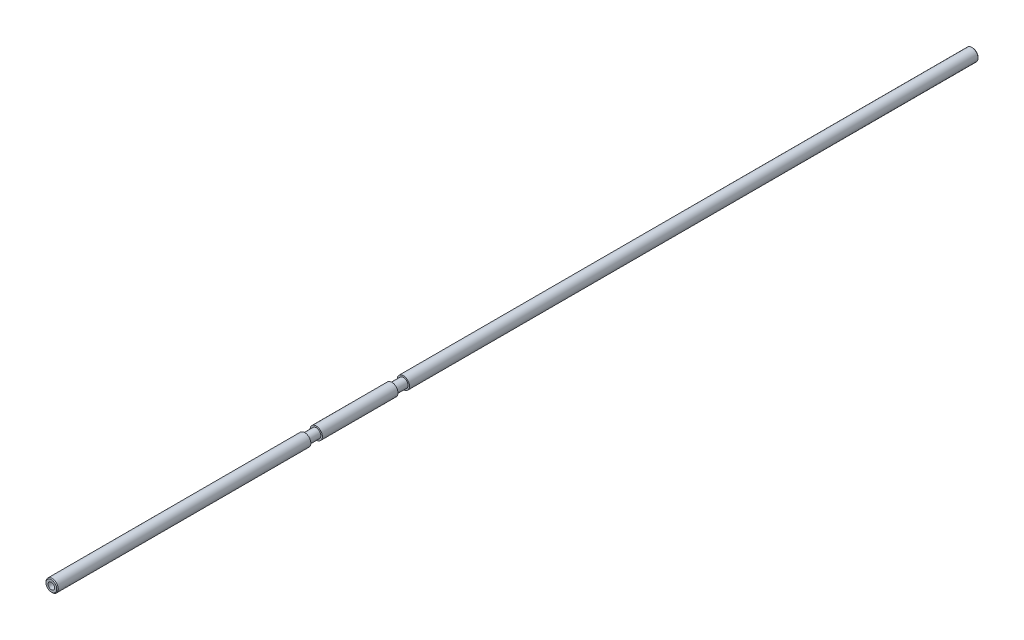
from build123d import *

# Parameters (mm, degrees)
BOSS_EXTRUDE1_START = 10
SKETCH1_R           = 8
BOSS_EXTRUDE1_DEPTH = 1200
CHAMFER1_SIZE       = 1
SKETCH2_R           = 4.25
CUT_EXTRUDE1_DEPTH  = 50
CUT_EXTRUDE2_START  = -50
SKETCH3_R           = 4.25
CUT_EXTRUDE2_DEPTH  = 50
CUT_EXTRUDE4_START  = -458.5
SKETCH5_R           = 8
SKETCH5_R_2         = 6
CUT_EXTRUDE4_DEPTH  = 15
CUT_EXTRUDE5_START  = -345
SKETCH5_2_R         = 8
SKETCH5_2_R_2       = 6
CUT_EXTRUDE5_DEPTH  = 15


with BuildPart() as part:
    # Sketch1 → Boss-Extrude1 (new body)
    with BuildSketch(Plane.XY.offset(BOSS_EXTRUDE1_START)):
        with Locations((45, 0)):
            Circle(SKETCH1_R)
    extrude(amount=BOSS_EXTRUDE1_DEPTH)

    # Chamfer1
    chamfer1_edges = [part.edges().sort_by_distance(p)[0] for p in [
        (37, 0, 1210),
        (37, 0, 10),
    ]]
    chamfer(chamfer1_edges, length=CHAMFER1_SIZE)

    # Sketch2 → Cut-Extrude1 (cut)
    with BuildSketch(Plane.XY.offset(1210)):
        with Locations((45, 0)):
            Circle(SKETCH2_R)
    extrude(amount=-CUT_EXTRUDE1_DEPTH, mode=Mode.SUBTRACT)

    # Sketch3 → Cut-Extrude2 (cut)
    with BuildSketch(Plane(origin=(0, 0, 10), x_dir=(-1, 0, 0), z_dir=(0, 0, -1)).offset(CUT_EXTRUDE2_START)):
        with Locations((-45, 0)):
            Circle(SKETCH3_R)
    extrude(amount=CUT_EXTRUDE2_DEPTH, mode=Mode.SUBTRACT)

    # Sketch5 → Cut-Extrude4 (cut)
    with BuildSketch(Plane.XY.offset(1210).offset(CUT_EXTRUDE4_START)):
        with Locations((45, 0)):
            Circle(SKETCH5_R)
        with Locations((45, 0)):
            Circle(SKETCH5_R_2, mode=Mode.SUBTRACT)
    extrude(amount=CUT_EXTRUDE4_DEPTH, mode=Mode.SUBTRACT)

    # Sketch5<2> → Cut-Extrude5 (cut)
    with BuildSketch(Plane.XY.offset(1210).offset(CUT_EXTRUDE5_START)):
        with Locations((45, 0)):
            Circle(SKETCH5_2_R)
        with Locations((45, 0)):
            Circle(SKETCH5_2_R_2, mode=Mode.SUBTRACT)
    extrude(amount=CUT_EXTRUDE5_DEPTH, mode=Mode.SUBTRACT)


solid = part.part
